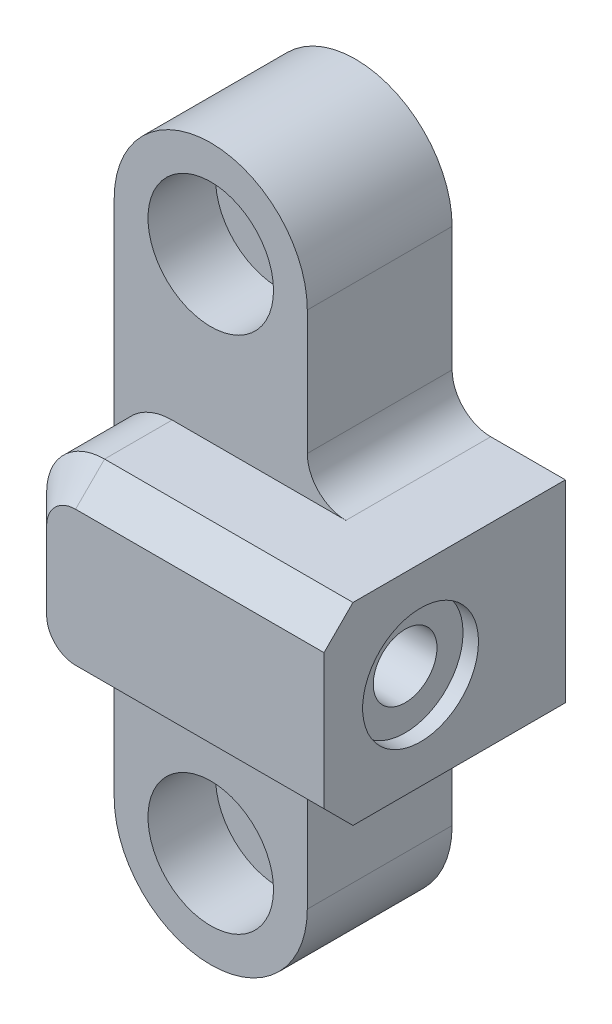
from build123d import *

# Parameters (mm, degrees)
SKETCH_1_W                   = 15.864971157
SKETCH_1_H                   = 12.5
EXTRUDE_1_DEPTH              = 10
EXTRUDE_2_DEPTH              = 7.5
EXTRUDE_3_DEPTH              = 7.5
HOLE_WIZARD_M3_1_D           = 3.3
HOLE_WIZARD_M3_1_DEPTH       = 9.8
HOLE_WIZARD_M3_1_CBORE_D     = 6
HOLE_WIZARD_M3_1_CBORE_DEPTH = 0.8
HOLE_WIZARD_M3_1_TIP         = 0.991420021
HOLE_WIZARD_M3_2_D           = 3.4
HOLE_WIZARD_M3_2_CBORE_D     = 6.5
HOLE_WIZARD_M3_2_CBORE_DEPTH = 3.5
FILLET_1_R                   = 3
CHAMFER_1_SIZE               = 1.5
FILLET_2_R                   = 2


with BuildPart() as part:
    # 草图1 → 凸台-拉伸1 (new body)
    with BuildSketch(Plane(origin=(0, 5, 0), x_dir=(1, 0, 0), z_dir=(0, 1, 0))):
        with Locations((16.367514422, -6.25)):
            Rectangle(SKETCH_1_W, SKETCH_1_H)
    extrude(amount=-EXTRUDE_1_DEPTH)

    # 草图2 → 凸台-拉伸2 (add)
    with BuildSketch(Plane(origin=(0, 0, 0), x_dir=(-1, 0, 0), z_dir=(0, 0, -1))):
        with BuildLine():
            Line((-8.435028843, -5), (-18.435028843, -5))
            Line((-18.435028843, -5), (-18.435028843, -13.435028843))
            ThreePointArc((-18.435028843, -13.435028843), (-13.435028843, -18.435028843), (-8.435028843, -13.435028843))
            Line((-8.435028843, -13.435028843), (-8.435028843, -5))
        make_face()
    extrude(amount=-EXTRUDE_2_DEPTH)

    # 草图3 → 凸台-拉伸3 (add)
    with BuildSketch(Plane(origin=(0, 0, 0), x_dir=(-1, 0, 0), z_dir=(0, 0, -1))):
        with BuildLine():
            Line((-8.435028843, 5), (-8.435028843, 13.435028843))
            ThreePointArc((-8.435028843, 13.435028843), (-13.435028843, 18.435028843), (-18.435028843, 13.435028843))
            Line((-18.435028843, 13.435028843), (-18.435028843, 5))
            Line((-18.435028843, 5), (-8.435028843, 5))
        make_face()
    extrude(amount=-EXTRUDE_3_DEPTH)

    # M3 六角头机械螺钉的柱形沉头孔1
    with Locations(Plane(origin=(24.3, 0, 0), x_dir=(0, 0, -1), z_dir=(1, 0, 0))):
        with Locations((-7.5, 0)):
            CounterBoreHole(HOLE_WIZARD_M3_1_D / 2, HOLE_WIZARD_M3_1_CBORE_D / 2, HOLE_WIZARD_M3_1_CBORE_DEPTH, depth=HOLE_WIZARD_M3_1_DEPTH)
            with Locations((0, 0, -(HOLE_WIZARD_M3_1_DEPTH + HOLE_WIZARD_M3_1_TIP / 2))):  # 118° drill point
                Cone(0, HOLE_WIZARD_M3_1_D / 2, HOLE_WIZARD_M3_1_TIP, mode=Mode.SUBTRACT)

    # M3 六角头机械螺钉的柱形沉头孔2 (through all)
    with Locations(Plane.XY.offset(7.5)):
        with Locations((13.435028843, 13.435028843), (13.435028843, -13.435028843)):
            CounterBoreHole(HOLE_WIZARD_M3_2_D / 2, HOLE_WIZARD_M3_2_CBORE_D / 2, HOLE_WIZARD_M3_2_CBORE_DEPTH)

    # 圆角1
    fillet_1_edges = [part.edges().sort_by_distance(p)[0] for p in [
        (8.435028843, -5, 10),
        (8.435028843, 5, 10),
    ]]
    fillet(fillet_1_edges, radius=FILLET_1_R)

    # 倒角1
    chamfer_1_edges = [part.edges().sort_by_distance(p)[0] for p in [
        (8.435028843, 0, 12.5),
        (17.867514421, 5, 12.5),
        (17.867514421, -5, 12.5),
        (9.313708499, 4.121320344, 12.5),
        (9.313708499, -4.121320344, 12.5),
    ]]
    chamfer(chamfer_1_edges, length=CHAMFER_1_SIZE)

    # 圆角2
    fillet_2_edges = [part.edges().sort_by_distance(p)[0] for p in [
        (18.435028843, -5, 3.75),
        (18.435028843, 5, 3.75),
    ]]
    fillet(fillet_2_edges, radius=FILLET_2_R)


solid = part.part
